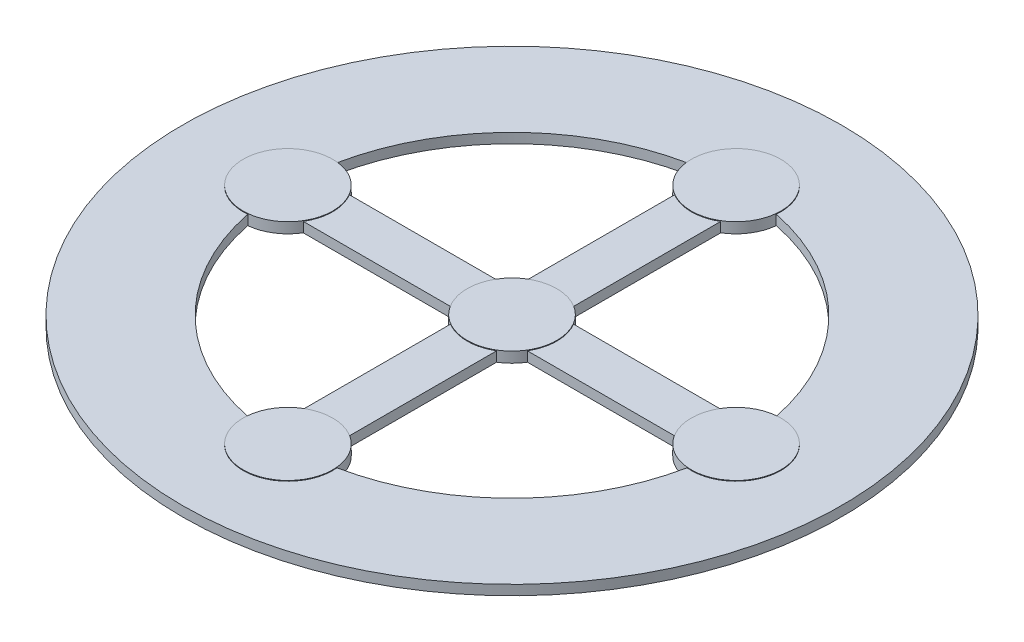
from build123d import *

# Parameters (mm, degrees)
SKETCH2_R           = 550
BOSS_EXTRUDE1_DEPTH = 15
SKETCH3_OUTSIDE_W   = 1413.142
SKETCH3_OUTSIDE_H   = 1413.142
SKETCH3_OUTSIDE_R   = 500
CUT_EXTRUDE1_DEPTH  = 30
BOSS_EXTRUDE2_START = 1
SKETCH4_R           = 68
BOSS_EXTRUDE2_DEPTH = 1
CIRPATTERN1_COUNT   = 4
BOSS_EXTRUDE3_START = 1
SKETCH5_R           = 68
BOSS_EXTRUDE3_DEPTH = 1


with BuildPart() as part:
    # Sketch2 → Boss-Extrude1 (new body)
    with BuildSketch(Plane(origin=(0, 0, 0), x_dir=(1, 0, 0), z_dir=(0, 1, 0))):
        with Locations(Location((0, 0, 0), (0, 0, 270))):
            Circle(SKETCH2_R)
    extrude(amount=BOSS_EXTRUDE1_DEPTH)

    # Sketch3 outside → Cut-Extrude1 (cut)
    # profile 1 of 5: a face of its own
    with BuildSketch(Plane(origin=(0, 15, 0), x_dir=(1, 0, 0), z_dir=(0, 1, 0))):
        Rectangle(SKETCH3_OUTSIDE_W, SKETCH3_OUTSIDE_H)
        with Locations(Location((0, 0, 0), (0, 0, 270))):
            Circle(SKETCH3_OUTSIDE_R, mode=Mode.SUBTRACT)
    # profile 2 of 5: a face of its own
    with BuildSketch(Plane(origin=(0, 15, 0), x_dir=(1, 0, 0), z_dir=(0, 1, 0))):
        with BuildLine():
            Line((-35, 58.300943389), (-35, 281.699056611))
            ThreePointArc((-35, 281.699056611), (-57.426577842, 303.583133614), (-67.659145723, 333.2))
            ThreePointArc((-67.659145723, 333.2), (-240.416305603, 240.416305603), (-333.2, 67.659145723))
            ThreePointArc((-333.2, 67.659145723), (-303.583133614, 57.426577842), (-281.699056611, 35))
            Line((-281.699056611, 35), (-58.300943389, 35))
            ThreePointArc((-58.300943389, 35), (-48.083261121, 48.083261121), (-35, 58.300943389))
        make_face()
    # profile 3 of 5: a face of its own
    with BuildSketch(Plane(origin=(0, 15, 0), x_dir=(1, 0, 0), z_dir=(0, 1, 0))):
        with BuildLine():
            Line((35, 281.699056611), (35, 58.300943389))
            ThreePointArc((35, 58.300943389), (48.083261121, 48.083261121), (58.300943389, 35))
            Line((58.300943389, 35), (281.699056611, 35))
            ThreePointArc((281.699056611, 35), (303.583133614, 57.426577842), (333.2, 67.659145723))
            ThreePointArc((333.2, 67.659145723), (240.416305603, 240.416305603), (67.659145723, 333.2))
            ThreePointArc((67.659145723, 333.2), (57.426577842, 303.583133614), (35, 281.699056611))
        make_face()
    # profile 4 of 5: a face of its own
    with BuildSketch(Plane(origin=(0, 15, 0), x_dir=(1, 0, 0), z_dir=(0, 1, 0))):
        with BuildLine():
            Line((281.699056611, -35), (58.300943389, -35))
            ThreePointArc((58.300943389, -35), (48.083261121, -48.083261121), (35, -58.300943389))
            Line((35, -58.300943389), (35, -281.699056611))
            ThreePointArc((35, -281.699056611), (57.426577842, -303.583133614), (67.659145723, -333.2))
            ThreePointArc((67.659145723, -333.2), (240.416305603, -240.416305603), (333.2, -67.659145723))
            ThreePointArc((333.2, -67.659145723), (303.583133614, -57.426577842), (281.699056611, -35))
        make_face()
    # profile 5 of 5: a face of its own
    with BuildSketch(Plane(origin=(0, 15, 0), x_dir=(1, 0, 0), z_dir=(0, 1, 0))):
        with BuildLine():
            Line((-35, -281.699056611), (-35, -58.300943389))
            ThreePointArc((-35, -58.300943389), (-48.083261121, -48.083261121), (-58.300943389, -35))
            Line((-58.300943389, -35), (-281.699056611, -35))
            ThreePointArc((-281.699056611, -35), (-303.583133614, -57.426577842), (-333.2, -67.659145723))
            ThreePointArc((-333.2, -67.659145723), (-240.416305603, -240.416305603), (-67.659145723, -333.2))
            ThreePointArc((-67.659145723, -333.2), (-57.426577842, -303.583133614), (-35, -281.699056611))
        make_face()
    extrude(amount=-CUT_EXTRUDE1_DEPTH, mode=Mode.SUBTRACT)

    # Sketch4 → Boss-Extrude2 (add)
    with BuildSketch(Plane(origin=(0, 15, 0), x_dir=(1, 0, 0), z_dir=(0, 1, 0)).offset(BOSS_EXTRUDE2_START)):
        with Locations(Location((0, 340, 0), (0, 0, 270))):
            Circle(SKETCH4_R)
    boss_extrude2 = extrude(amount=-BOSS_EXTRUDE2_DEPTH)

    # CirPattern1: Boss-Extrude2 ×4 about axis
    cirpattern1_axis = Axis((0, 15, 0), (0, 1, 0))
    for i in range(1, CIRPATTERN1_COUNT):
        add(boss_extrude2.rotate(cirpattern1_axis, i * 360 / CIRPATTERN1_COUNT))

    # Sketch5 → Boss-Extrude3 (add)
    with BuildSketch(Plane(origin=(0, 15, 0), x_dir=(1, 0, 0), z_dir=(0, 1, 0)).offset(BOSS_EXTRUDE3_START)):
        with Locations(Location((0, 0, 0), (0, 0, 270))):
            Circle(SKETCH5_R)
    extrude(amount=-BOSS_EXTRUDE3_DEPTH)


solid = part.part
